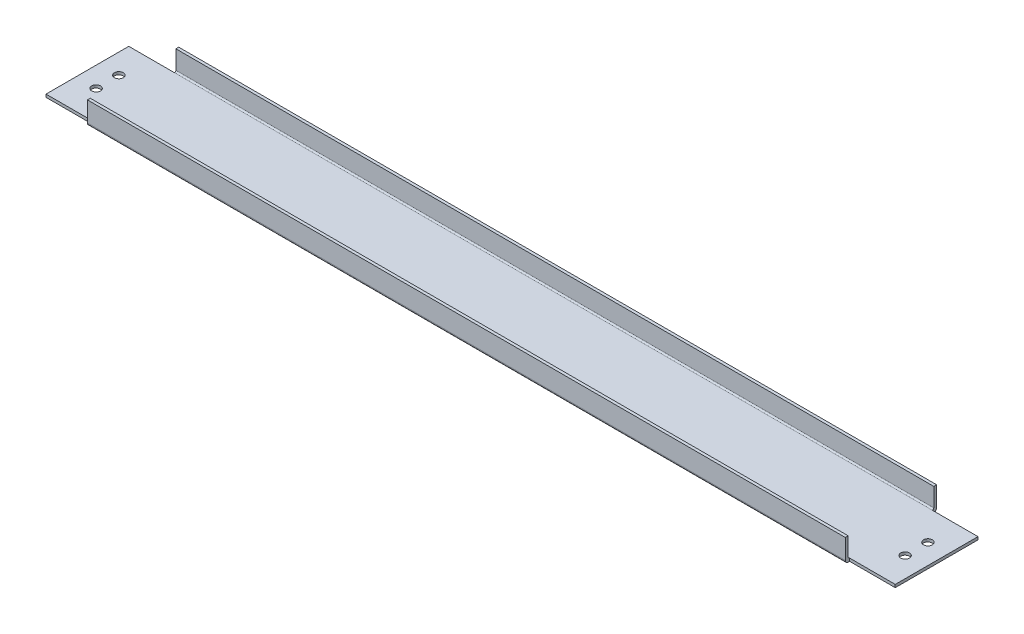
from build123d import *

# Parameters (mm, degrees)
BOSS_EXTRUDE1_DEPTH   = 210.82
SKETCH2_W             = 46.0375
SKETCH2_H             = 1.5875
BOSS_EXTRUDE2_DEPTH   = 25.4
SKETCH3_R             = 0.635
CUT_EXTRUDE1_DEPTH    = 238.841409465
F_8_CLEARANCE_HOLE1_D = 4.9149


with BuildPart() as part:
    # Sketch1 → Boss-Extrude1 (new body)
    with BuildSketch(Plane(origin=(0, 0, 0), x_dir=(0, 0, -1), z_dir=(1, 0, 0))):
        with BuildLine():
            Line((-23.8125, 0), (23.8125, 0))
            ThreePointArc((23.8125, 0), (24.935032015, 0.464967985), (25.4, 1.5875))
            Line((25.4, 1.5875), (25.4, 12.7))
            Line((25.4, 12.7), (23.8125, 12.7))
            Line((23.8125, 12.7), (23.8125, 2.38125))
            ThreePointArc((23.8125, 2.38125), (23.580016008, 1.819983992), (23.01875, 1.5875))
            Line((23.01875, 1.5875), (-23.01875, 1.5875))
            ThreePointArc((-23.01875, 1.5875), (-23.580016008, 1.819983992), (-23.8125, 2.38125))
            Line((-23.8125, 2.38125), (-23.8125, 12.7))
            Line((-23.8125, 12.7), (-25.4, 12.7))
            Line((-25.4, 12.7), (-25.4, 1.5875))
            ThreePointArc((-25.4, 1.5875), (-24.935032015, 0.464967985), (-23.8125, 0))
        make_face()
    boss_extrude1 = extrude(amount=BOSS_EXTRUDE1_DEPTH)

    # Sketch2 → Boss-Extrude2 (add)
    with BuildSketch(Plane(origin=(210.82, 0, 0), x_dir=(0, 0, -1), z_dir=(1, 0, 0))):
        with Locations((0, 0.79375)):
            Rectangle(SKETCH2_W, SKETCH2_H)
    boss_extrude2 = extrude(amount=BOSS_EXTRUDE2_DEPTH)

    # Mirror1: Boss-Extrude1, Boss-Extrude2 across plane
    add(boss_extrude1.mirror(Plane(origin=(0, 0, 0), x_dir=(0, 0, 1), z_dir=(1, 0, 0))))
    add(boss_extrude2.mirror(Plane(origin=(0, 0, 0), x_dir=(0, 0, 1), z_dir=(1, 0, 0))))

    # Sketch3 → Cut-Extrude1 (cut, through all)
    with BuildSketch(Plane(origin=(0, 1.5875, 0), x_dir=(1, 0, 0), z_dir=(0, 1, 0))):
        with Locations(Location((225.044, -6.35, 0), (0, 0, 270))):
            Circle(SKETCH3_R)
        with Locations(Location((225.044, 6.35, 0), (0, 0, 270))):
            Circle(SKETCH3_R)
    extrude(amount=-CUT_EXTRUDE1_DEPTH, mode=Mode.SUBTRACT)

    # #8 Clearance Hole1 (through all)
    with Locations(Plane(origin=(0, 1.5875, 0), x_dir=(1, 0, 0), z_dir=(0, 1, 0))):
        with Locations((225.044, -6.35), (225.044, 6.35)):
            f_8_clearance_hole1 = Hole(F_8_CLEARANCE_HOLE1_D / 2)

    # Mirror2: #8 Clearance Hole1 across plane
    add(f_8_clearance_hole1.mirror(Plane(origin=(0, 0, 0), x_dir=(0, 0, 1), z_dir=(1, 0, 0))), mode=Mode.SUBTRACT)


solid = part.part
